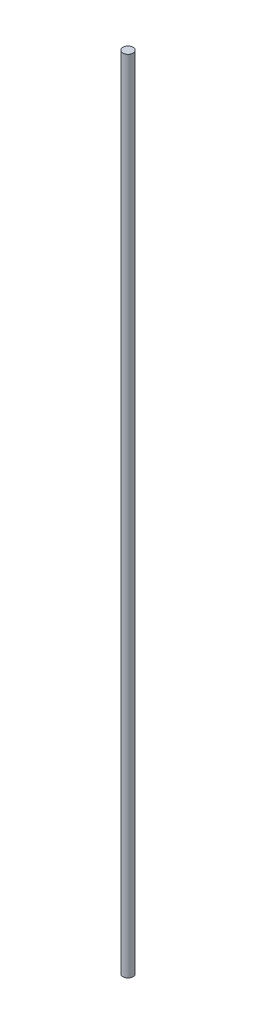
from build123d import *

# Parameters (mm, degrees)
SKETCH1_R           = 1.61925
BOSS_EXTRUDE1_DEPTH = 254


with BuildPart() as part:
    # Sketch1 → Boss-Extrude1 (new body)
    with BuildSketch(Plane(origin=(0, 0, 0), x_dir=(1, 0, 0), z_dir=(0, 1, 0))):
        with Locations(Location((0, 0, 0), (0, 0, 270))):
            Circle(SKETCH1_R)
    extrude(amount=BOSS_EXTRUDE1_DEPTH)


solid = part.part
